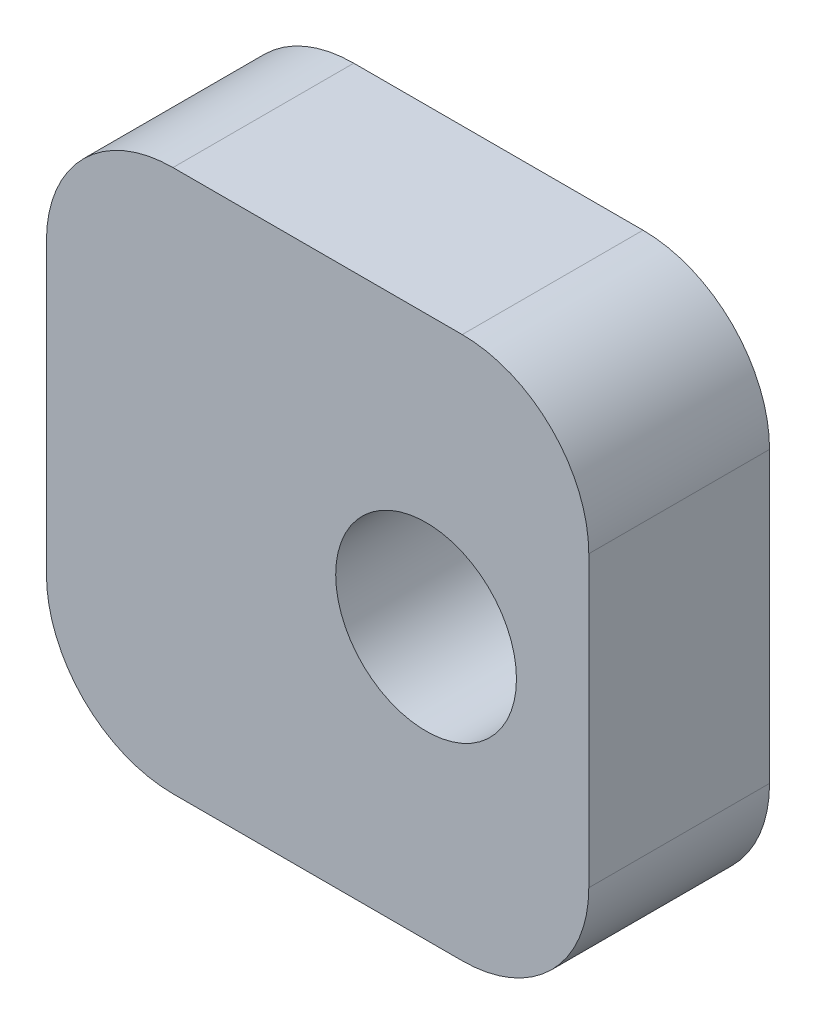
from build123d import *

# Parameters (mm, degrees)
SKETCH_1_W          = 30
SKETCH_1_H          = 30
EXTRUDE_1_DEPTH     = 10
CUT_EXTRUDE_1_REACH = 45.589
SKETCH_2_R          = 5
FILLET_1_R          = 7
SKETCH_3_R          = 3
CUT_EXTRUDE_2_DEPTH = 12


with BuildPart() as part:
    # 草图1 → 凸台-拉伸1 (new body)
    with BuildSketch(Plane.XY):
        with Locations((15, 15)):
            Rectangle(SKETCH_1_W, SKETCH_1_H)
    extrude(amount=EXTRUDE_1_DEPTH)

    # 草图2 → 切除-拉伸1 (cut, up to next)
    with BuildSketch(Plane(origin=(0, 0, 0), x_dir=(-1, 0, 0), z_dir=(0, 0, -1)), mode=Mode.PRIVATE) as cut_extrude_1_sk1:
        with Locations((-21, 15)):
            Circle(SKETCH_2_R)
    cut_extrude_1_tool1 = extrude(cut_extrude_1_sk1.sketch, amount=-CUT_EXTRUDE_1_REACH, mode=Mode.PRIVATE) & part.part
    add(cut_extrude_1_tool1.solids().sort_by_distance((21, 15, 0))[0], mode=Mode.SUBTRACT)

    # 圆角1
    fillet_1_edges = [part.edges().sort_by_distance(p)[0] for p in [
        (0, 30, 5),
        (30, 30, 5),
        (30, 0, 5),
        (0, 0, 5),
    ]]
    fillet(fillet_1_edges, radius=FILLET_1_R)

    # 草图3 → 切除-拉伸2 (cut)
    with BuildSketch(Plane.ZY):
        with Locations((5, 15)):
            Circle(SKETCH_3_R)
    extrude(amount=-CUT_EXTRUDE_2_DEPTH, mode=Mode.SUBTRACT)


solid = part.part
